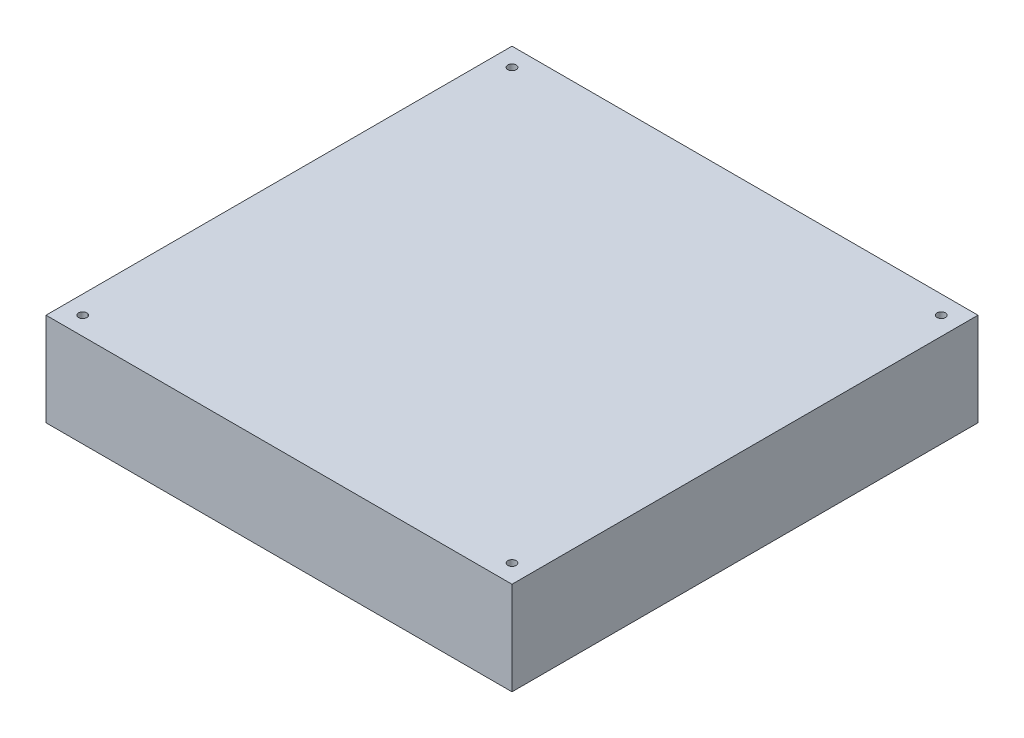
from build123d import *

# Parameters (mm, degrees)
SKETCH1_W           = 127
SKETCH1_H           = 127
BOSS_EXTRUDE1_DEPTH = 25.4
SKETCH4_R           = 1.1303
CUT_EXTRUDE1_DEPTH  = 25.4


with BuildPart() as part:
    # Sketch1 → Boss-Extrude1 (new body)
    with BuildSketch(Plane(origin=(0, 0, 0), x_dir=(1, 0, 0), z_dir=(0, 1, 0))):
        Rectangle(SKETCH1_W, SKETCH1_H)
    extrude(amount=BOSS_EXTRUDE1_DEPTH)

    # Sketch4 → Cut-Extrude1 (cut)
    with BuildSketch(Plane(origin=(0, 25.4, 0), x_dir=(1, 0, 0), z_dir=(0, 1, 0))):
        with Locations(Location((-58.5, -58.5, 0), (0, 0, 270))):
            Circle(SKETCH4_R)
        with Locations(Location((58.5, -58.5, 0), (0, 0, 270))):
            Circle(SKETCH4_R)
        with Locations(Location((58.5, 58.5, 0), (0, 0, 270))):
            Circle(SKETCH4_R)
        with Locations(Location((-58.5, 58.5, 0), (0, 0, 270))):
            Circle(SKETCH4_R)
    extrude(amount=-CUT_EXTRUDE1_DEPTH, mode=Mode.SUBTRACT)


solid = part.part
